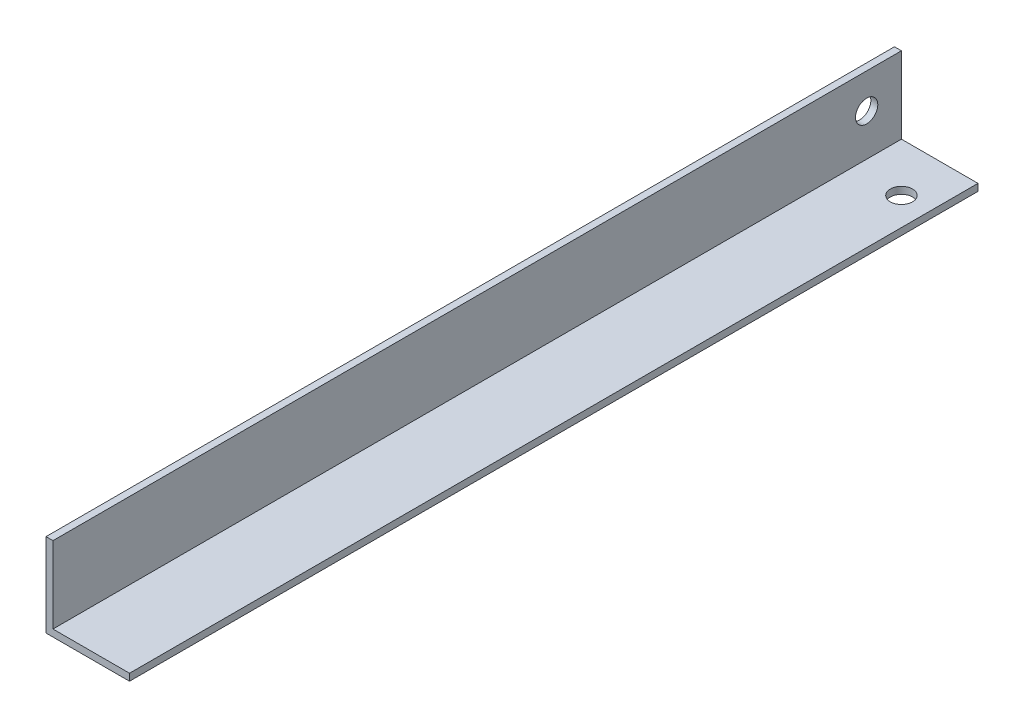
from build123d import *

# Parameters (mm, degrees)
BOSS_EXTRUDE1_DEPTH = 304.8
SKETCH2_R           = 4
CUT_EXTRUDE1_DEPTH  = 308.50494305
SKETCH3_R           = 4
CUT_EXTRUDE2_DEPTH  = 308.50494305


with BuildPart() as part:
    # Sketch1 → Boss-Extrude1 (new body)
    with BuildSketch(Plane.XY):
        Polygon((0, 0), (0, 30), (2.5, 30), (2.5, 2.5), (30, 2.5), (30, 0), align=None)
    extrude(amount=BOSS_EXTRUDE1_DEPTH)

    # Sketch2 → Cut-Extrude1 (cut, through all)
    with BuildSketch(Plane(origin=(0, 2.5, 0), x_dir=(1, 0, 0), z_dir=(0, 1, 0))):
        with Locations(Location((20, -17.5, 0), (0, 0, 180))):
            Circle(SKETCH2_R)
    extrude(amount=-CUT_EXTRUDE1_DEPTH, mode=Mode.SUBTRACT)

    # Sketch3 → Cut-Extrude2 (cut, through all)
    with BuildSketch(Plane(origin=(2.5, 0, 0), x_dir=(0, 0, -1), z_dir=(1, 0, 0))):
        with Locations(Location((-12.5, 17.5, 0), (0, 0, 90))):
            Circle(SKETCH3_R)
    extrude(amount=-CUT_EXTRUDE2_DEPTH, mode=Mode.SUBTRACT)


solid = part.part
